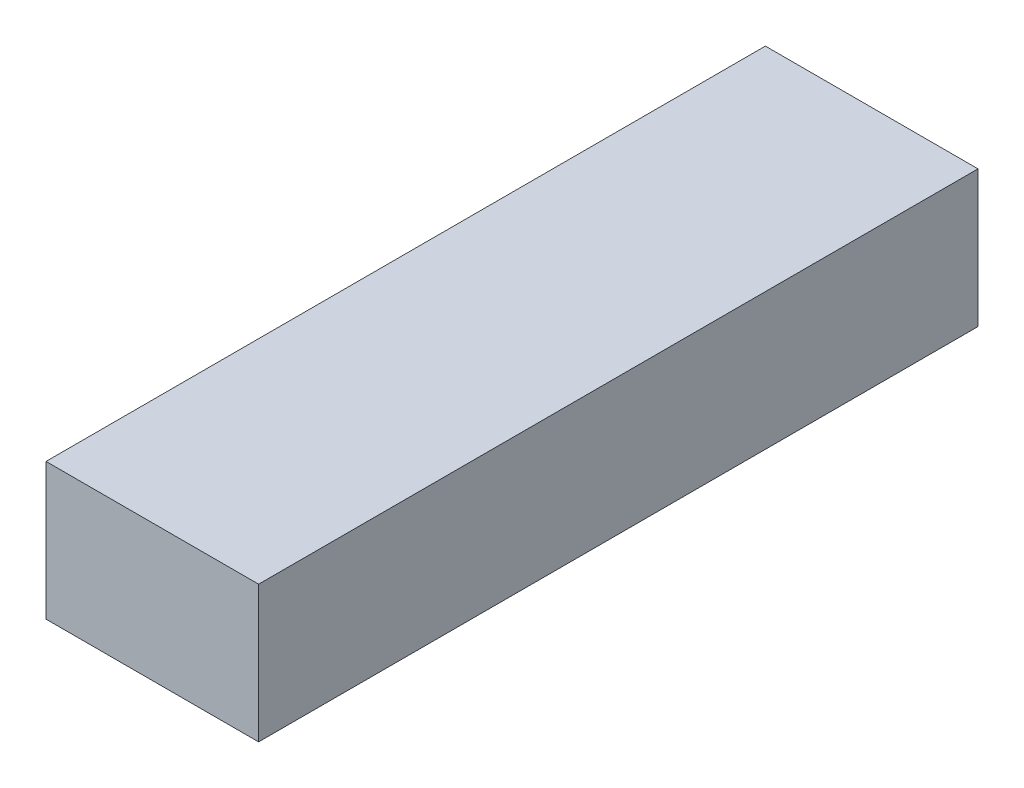
from build123d import *

# Parameters (mm, degrees)
SKETCH1_W           = 49.022
SKETCH1_H           = 31.496
BOSS_EXTRUDE1_DEPTH = 165.862


with BuildPart() as part:
    # Sketch1 → Boss-Extrude1 (new body)
    with BuildSketch(Plane.XY):
        Rectangle(SKETCH1_W, SKETCH1_H)
    extrude(amount=BOSS_EXTRUDE1_DEPTH)


solid = part.part
